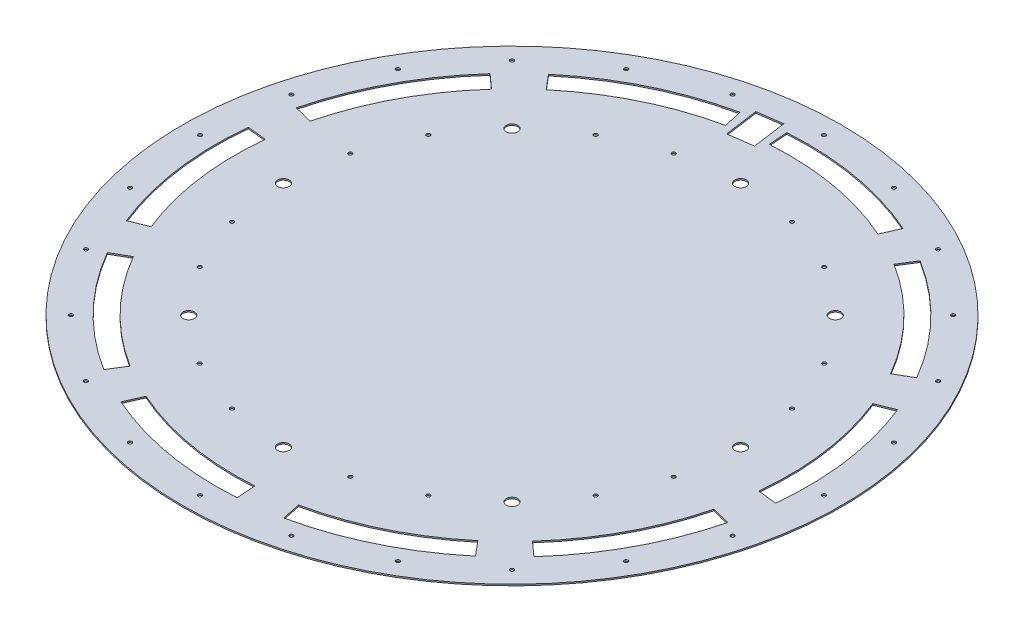
from build123d import *

# Parameters (mm, degrees)
SKETCH1_R           = 346
SKETCH1_R_2         = 6
SKETCH1_R_3         = 2
BOSS_EXTRUDE1_DEPTH = 0.75


with BuildPart() as part:
    # Sketch1 → Boss-Extrude1 (new, symmetric)
    with BuildSketch(Plane(origin=(0, 0, 0), x_dir=(1, 0, 0), z_dir=(0, 1, 0))):
        with Locations(Location((0, 0, 0), (0, 0, 270))):
            Circle(SKETCH1_R)
        with Locations(Location((0, 240, 0), (0, 0, 270))):
            Circle(SKETCH1_R_2, mode=Mode.SUBTRACT)
        with Locations(Location((169.705627485, 169.705627485, 0), (0, 0, 270))):
            Circle(SKETCH1_R_2, mode=Mode.SUBTRACT)
        with Locations(Location((240, 0, 0), (0, 0, 270))):
            Circle(SKETCH1_R_2, mode=Mode.SUBTRACT)
        with Locations(Location((169.705627485, -169.705627485, 0), (0, 0, 270))):
            Circle(SKETCH1_R_2, mode=Mode.SUBTRACT)
        with Locations(Location((0, -240, 0), (0, 0, 270))):
            Circle(SKETCH1_R_2, mode=Mode.SUBTRACT)
        with Locations(Location((-169.705627485, -169.705627485, 0), (0, 0, 270))):
            Circle(SKETCH1_R_2, mode=Mode.SUBTRACT)
        with Locations(Location((-240, 0, 0), (0, 0, 270))):
            Circle(SKETCH1_R_2, mode=Mode.SUBTRACT)
        with Locations(Location((-169.705627485, 169.705627485, 0), (0, 0, 270))):
            Circle(SKETCH1_R_2, mode=Mode.SUBTRACT)
        with Locations(Location((-231.822198309, 62.116570825, 0), (0, 0, 270))):
            Circle(SKETCH1_R_3, mode=Mode.SUBTRACT)
        with Locations(Location((-207.846062834, 120.000258819, 0), (0, 0, 270))):
            Circle(SKETCH1_R_3, mode=Mode.SUBTRACT)
        with Locations(Location((-119.999707107, 207.846804015, 0), (0, 0, 270))):
            Circle(SKETCH1_R_3, mode=Mode.SUBTRACT)
        with Locations(Location((-62.116070825, 231.823064335, 0), (0, 0, 270))):
            Circle(SKETCH1_R_3, mode=Mode.SUBTRACT)
        with Locations(Location((62.117570825, 231.823198309, 0), (0, 0, 270))):
            Circle(SKETCH1_R_3, mode=Mode.SUBTRACT)
        with Locations(Location((120.001258819, 207.847062834, 0), (0, 0, 270))):
            Circle(SKETCH1_R_3, mode=Mode.SUBTRACT)
        with Locations(Location((207.847804015, 120.000707107, 0), (0, 0, 270))):
            Circle(SKETCH1_R_3, mode=Mode.SUBTRACT)
        with Locations(Location((231.824064335, 62.117070825, 0), (0, 0, 270))):
            Circle(SKETCH1_R_3, mode=Mode.SUBTRACT)
        with Locations(Location((231.824198309, -62.116570825, 0), (0, 0, 270))):
            Circle(SKETCH1_R_3, mode=Mode.SUBTRACT)
        with Locations(Location((207.848062834, -120.000258819, 0), (0, 0, 270))):
            Circle(SKETCH1_R_3, mode=Mode.SUBTRACT)
        with Locations(Location((120.001707107, -207.846804015, 0), (0, 0, 270))):
            Circle(SKETCH1_R_3, mode=Mode.SUBTRACT)
        with Locations(Location((62.118070825, -231.823064335, 0), (0, 0, 270))):
            Circle(SKETCH1_R_3, mode=Mode.SUBTRACT)
        with Locations(Location((-62.115570825, -231.823198309, 0), (0, 0, 270))):
            Circle(SKETCH1_R_3, mode=Mode.SUBTRACT)
        with Locations(Location((-119.999258819, -207.847062834, 0), (0, 0, 270))):
            Circle(SKETCH1_R_3, mode=Mode.SUBTRACT)
        with Locations(Location((-207.845804015, -120.000707107, 0), (0, 0, 270))):
            Circle(SKETCH1_R_3, mode=Mode.SUBTRACT)
        with Locations(Location((-231.822064335, -62.117070825, 0), (0, 0, 270))):
            Circle(SKETCH1_R_3, mode=Mode.SUBTRACT)
        with Locations(Location((-316.34070811, 84.763237271, 0), (0, 0, 270))):
            Circle(SKETCH1_R_3, mode=Mode.SUBTRACT)
        with Locations(Location((-283.623319739, 163.75, 0), (0, 0, 270))):
            Circle(SKETCH1_R_3, mode=Mode.SUBTRACT)
        with Locations(Location((-231.577470839, 231.577470839, 0), (0, 0, 270))):
            Circle(SKETCH1_R_3, mode=Mode.SUBTRACT)
        with Locations(Location((-163.75, 283.623319739, 0), (0, 0, 270))):
            Circle(SKETCH1_R_3, mode=Mode.SUBTRACT)
        with Locations(Location((-84.763237271, 316.34070811, 0), (0, 0, 270))):
            Circle(SKETCH1_R_3, mode=Mode.SUBTRACT)
        with Locations(Location((0, 327.5, 0), (0, 0, 270))):
            Circle(SKETCH1_R_3, mode=Mode.SUBTRACT)
        with Locations(Location((84.763237271, 316.34070811, 0), (0, 0, 270))):
            Circle(SKETCH1_R_3, mode=Mode.SUBTRACT)
        with Locations(Location((163.75, 283.623319739, 0), (0, 0, 270))):
            Circle(SKETCH1_R_3, mode=Mode.SUBTRACT)
        with Locations(Location((231.577470839, 231.577470839, 0), (0, 0, 270))):
            Circle(SKETCH1_R_3, mode=Mode.SUBTRACT)
        with Locations(Location((283.623319739, 163.75, 0), (0, 0, 270))):
            Circle(SKETCH1_R_3, mode=Mode.SUBTRACT)
        with Locations(Location((316.34070811, 84.763237271, 0), (0, 0, 270))):
            Circle(SKETCH1_R_3, mode=Mode.SUBTRACT)
        with Locations(Location((327.5, 0, 0), (0, 0, 270))):
            Circle(SKETCH1_R_3, mode=Mode.SUBTRACT)
        with Locations(Location((316.34070811, -84.763237271, 0), (0, 0, 270))):
            Circle(SKETCH1_R_3, mode=Mode.SUBTRACT)
        with Locations(Location((283.623319739, -163.75, 0), (0, 0, 270))):
            Circle(SKETCH1_R_3, mode=Mode.SUBTRACT)
        with Locations(Location((231.577470839, -231.577470839, 0), (0, 0, 270))):
            Circle(SKETCH1_R_3, mode=Mode.SUBTRACT)
        with Locations(Location((163.75, -283.623319739, 0), (0, 0, 270))):
            Circle(SKETCH1_R_3, mode=Mode.SUBTRACT)
        with Locations(Location((84.763237271, -316.34070811, 0), (0, 0, 270))):
            Circle(SKETCH1_R_3, mode=Mode.SUBTRACT)
        with Locations(Location((0, -327.5, 0), (0, 0, 270))):
            Circle(SKETCH1_R_3, mode=Mode.SUBTRACT)
        with Locations(Location((-84.763237271, -316.34070811, 0), (0, 0, 270))):
            Circle(SKETCH1_R_3, mode=Mode.SUBTRACT)
        with Locations(Location((-163.75, -283.623319739, 0), (0, 0, 270))):
            Circle(SKETCH1_R_3, mode=Mode.SUBTRACT)
        with Locations(Location((-231.577470839, -231.577470839, 0), (0, 0, 270))):
            Circle(SKETCH1_R_3, mode=Mode.SUBTRACT)
        with Locations(Location((-283.623319739, -163.75, 0), (0, 0, 270))):
            Circle(SKETCH1_R_3, mode=Mode.SUBTRACT)
        with Locations(Location((-316.34070811, -84.763237271, 0), (0, 0, 270))):
            Circle(SKETCH1_R_3, mode=Mode.SUBTRACT)
        with Locations(Location((-327.5, 0, 0), (0, 0, 270))):
            Circle(SKETCH1_R_3, mode=Mode.SUBTRACT)
        Polygon((-57.130530999, 313.095995547), (-31.383561212, 316.714496172), (-26.373329577, 281.064845698), (-52.120299364, 277.446345073), align=None, mode=Mode.SUBTRACT)
        with BuildLine():
            Line((-20.29913386, 290.291138626), (-21.694263334, 310.242419631))
            ThreePointArc((-21.694263334, 310.242419631), (54.004583254, 306.275211187), (126.495095997, 284.112637327))
            Line((126.495095997, 284.112637327), (118.360363135, 265.841728174))
            ThreePointArc((118.360363135, 265.841728174), (50.531619701, 286.579056127), (-20.29913386, 290.291138626))
        make_face(mode=Mode.SUBTRACT)
        with BuildLine():
            Line((269.333900577, 155.5), (252.013392501, 145.5))
            ThreePointArc((252.013392501, 145.5), (209.327881899, 202.145585804), (154.206505892, 246.781995982))
            Line((154.206505892, 246.781995982), (164.804891177, 263.742957905))
            ThreePointArc((164.804891177, 263.742957905), (223.714677905, 216.038753213), (269.333900577, 155.5))
        make_face(mode=Mode.SUBTRACT)
        with BuildLine():
            Line((309.29630946, -32.508352076), (289.405871552, -30.417782811))
            ThreePointArc((289.405871552, -30.417782811), (288.168008004, 40.499372379), (269.810501679, 109.010518684))
            Line((269.810501679, 109.010518684), (288.35417877, 116.502650552))
            ThreePointArc((288.35417877, 116.502650552), (307.973369379, 43.282834399), (309.29630946, -32.508352076))
        make_face(mode=Mode.SUBTRACT)
        with BuildLine():
            Line((231.118040723, -208.099618578), (216.255144214, -194.71700645))
            ThreePointArc((216.255144214, -194.71700645), (256.937749522, -136.616224771), (282.356056346, -70.39927162))
            Line((282.356056346, -70.39927162), (301.761970872, -75.237709532))
            ThreePointArc((301.761970872, -75.237709532), (274.596701379, -146.005656026), (231.118040723, -208.099618578))
        make_face(mode=Mode.SUBTRACT)
        with BuildLine():
            Line((64.660535844, -304.203903828), (60.502302028, -284.640951814))
            ThreePointArc((60.502302028, -284.640951814), (127.566003716, -261.549067473), (187.051194419, -222.918932948))
            Line((187.051194419, -222.918932948), (199.906946613, -238.23982181))
            ThreePointArc((199.906946613, -238.23982181), (136.333426651, -279.524948399), (64.660535844, -304.203903828))
        make_face(mode=Mode.SUBTRACT)
        with BuildLine():
            Line((-126.495095997, -284.112637327), (-118.360363135, -265.841728174))
            ThreePointArc((-118.360363135, -265.841728174), (-50.531619701, -286.579056127), (20.29913386, -290.291138626))
            Line((20.29913386, -290.291138626), (21.694263334, -310.242419631))
            ThreePointArc((21.694263334, -310.242419631), (-54.004583254, -306.275211187), (-126.495095997, -284.112637327))
        make_face(mode=Mode.SUBTRACT)
        with BuildLine():
            Line((-269.333900577, -155.5), (-252.013392501, -145.5))
            ThreePointArc((-252.013392501, -145.5), (-209.327881899, -202.145585804), (-154.206505892, -246.781995982))
            Line((-154.206505892, -246.781995982), (-164.804891177, -263.742957905))
            ThreePointArc((-164.804891177, -263.742957905), (-223.714677905, -216.038753213), (-269.333900577, -155.5))
        make_face(mode=Mode.SUBTRACT)
        with BuildLine():
            Line((-309.29630946, 32.508352076), (-289.405871552, 30.417782811))
            ThreePointArc((-289.405871552, 30.417782811), (-288.168008004, -40.499372379), (-269.810501679, -109.010518684))
            Line((-269.810501679, -109.010518684), (-288.35417877, -116.502650552))
            ThreePointArc((-288.35417877, -116.502650552), (-307.973369379, -43.282834399), (-309.29630946, 32.508352076))
        make_face(mode=Mode.SUBTRACT)
        with BuildLine():
            Line((-231.118040723, 208.099618578), (-216.255144214, 194.71700645))
            ThreePointArc((-216.255144214, 194.71700645), (-256.937749522, 136.616224771), (-282.356056346, 70.39927162))
            Line((-282.356056346, 70.39927162), (-301.761970872, 75.237709531))
            ThreePointArc((-301.761970872, 75.237709531), (-274.596701379, 146.005656026), (-231.118040723, 208.099618578))
        make_face(mode=Mode.SUBTRACT)
        with BuildLine():
            Line((-64.660535844, 304.203903828), (-60.502302028, 284.640951814))
            ThreePointArc((-60.502302028, 284.640951814), (-127.566003716, 261.549067473), (-187.051194419, 222.918932948))
            Line((-187.051194419, 222.918932948), (-199.906946612, 238.23982181))
            ThreePointArc((-199.906946612, 238.23982181), (-136.333426651, 279.524948399), (-64.660535844, 304.203903828))
        make_face(mode=Mode.SUBTRACT)
    extrude(amount=BOSS_EXTRUDE1_DEPTH, both=True)


solid = part.part
